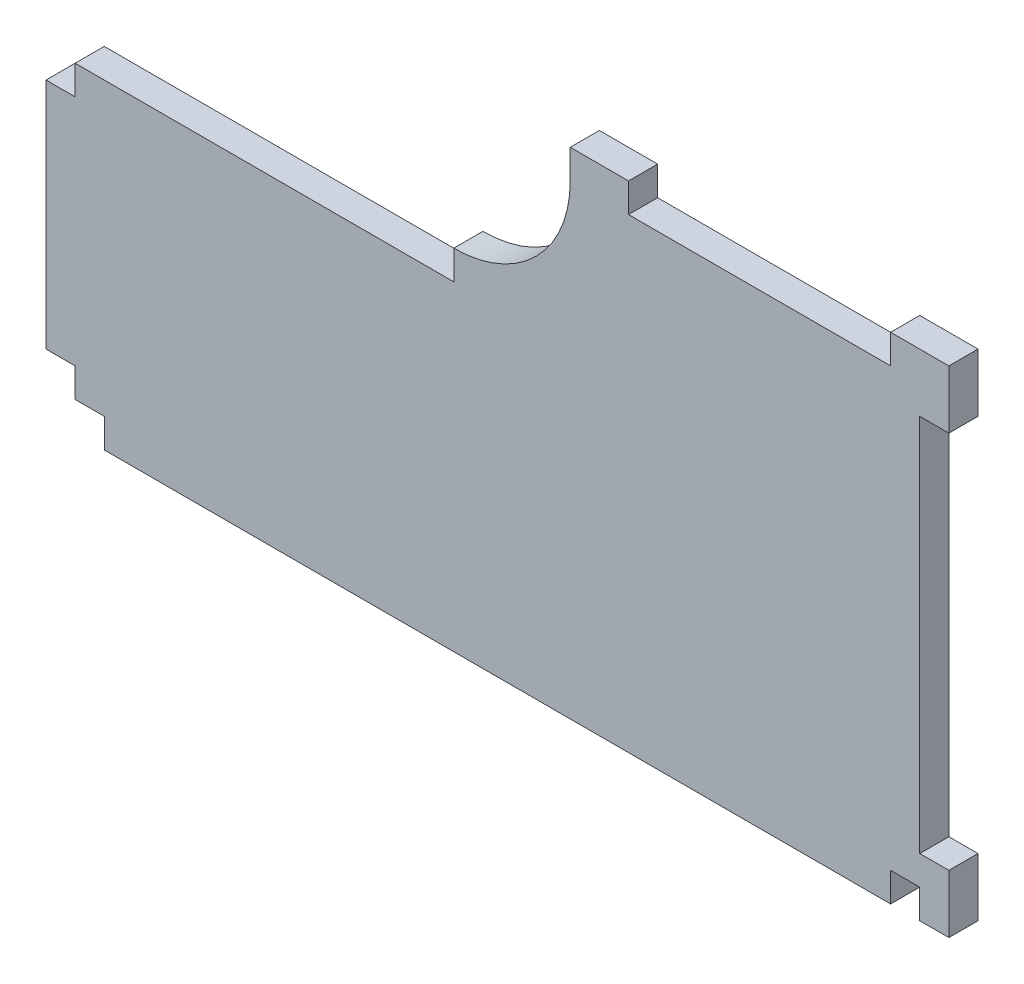
from build123d import *

# Parameters (mm, degrees)
SKETCH1_W           = 196.85
SKETCH1_H           = 107.95
BOSS_EXTRUDE1_DEPTH = 6.35
SKETCH2_W           = 57.15
SKETCH2_H           = 6.35
SKETCH2_W_2         = 6.35
SKETCH2_H_2         = 82.55
CUT_EXTRUDE1_DEPTH  = 154.060029074


with BuildPart() as part:
    # Sketch1 → Boss-Extrude1 (new body)
    with BuildSketch(Plane.XY):
        with Locations((-15.875, 47.625)):
            Rectangle(SKETCH1_W, SKETCH1_H)
    extrude(amount=-BOSS_EXTRUDE1_DEPTH)

    # Sketch2 → Cut-Extrude1 (cut, through all)
    with BuildSketch(Plane.XY):
        with BuildLine():
            Line((0, 101.6), (0, 95.25))
            ThreePointArc((0, 95.25), (-7.439487758, 77.289487758), (-25.4, 69.85))
            Line((-25.4, 69.85), (-25.4, 63.5))
            Line((-25.4, 63.5), (-107.95, 63.5))
            Line((-107.95, 63.5), (-107.95, 57.15))
            Line((-107.95, 57.15), (-114.3, 57.15))
            Line((-114.3, 57.15), (-114.3, 69.85))
            Line((-114.3, 69.85), (-114.3, 101.6))
            Line((-114.3, 101.6), (0, 101.6))
        make_face()
        with Locations((41.275, 98.425)):
            Rectangle(SKETCH2_W, SKETCH2_H)
        with Locations((79.375, 47.625)):
            Rectangle(SKETCH2_W_2, SKETCH2_H_2)
        Polygon((-114.3, -6.35), (-101.6, -6.35), (-101.6, 0), (-107.95, 0), (-107.95, 6.35), (-114.3, 6.35), align=None)
        with Locations((73.025, -3.175)):
            Rectangle(SKETCH2_W_2, SKETCH2_H)
    extrude(amount=-CUT_EXTRUDE1_DEPTH, mode=Mode.SUBTRACT)


solid = part.part
